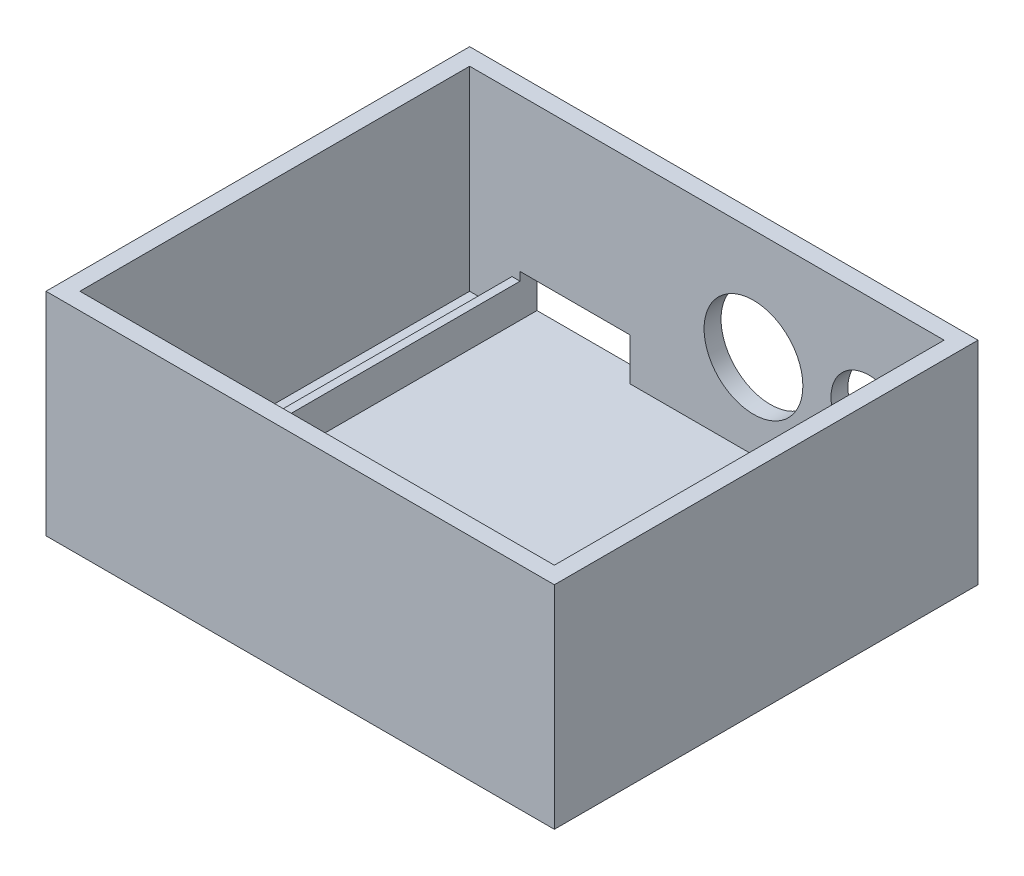
from build123d import *

# Parameters (mm, degrees)
SKETCH1_W           = 120
SKETCH1_H           = 100
BOSS_EXTRUDE1_DEPTH = 50
SKETCH2_W           = 112
SKETCH2_H           = 92
CUT_EXTRUDE1_DEPTH  = 46
SKETCH3_W           = 24.6
SKETCH3_H           = 70
BOSS_EXTRUDE3_DEPTH = 8
SKETCH6_W           = 24.61
SKETCH6_H           = 8
CUT_EXTRUDE4_DEPTH  = 66
SKETCH7_W           = 26
SKETCH7_H           = 10
CUT_EXTRUDE6_DEPTH  = 66
SKETCH10_R          = 9
CUT_EXTRUDE9_DEPTH  = 12.5
SKETCH8_R           = 11.662197426
CUT_EXTRUDE10_DEPTH = 10


with BuildPart() as part:
    # Sketch1 → Boss-Extrude1 (new body)
    with BuildSketch(Plane(origin=(0, 0, 0), x_dir=(1, 0, 0), z_dir=(0, 1, 0))):
        with Locations((-10.571222942, 10.082692781)):
            Rectangle(SKETCH1_W, SKETCH1_H)
    extrude(amount=BOSS_EXTRUDE1_DEPTH)

    # Sketch2 → Cut-Extrude1 (cut)
    with BuildSketch(Plane(origin=(0, 50, 0), x_dir=(1, 0, 0), z_dir=(0, 1, 0))):
        with Locations((-10.571222942, 10.082692781)):
            Rectangle(SKETCH2_W, SKETCH2_H)
    extrude(amount=-CUT_EXTRUDE1_DEPTH, mode=Mode.SUBTRACT)

    # Sketch3 → Boss-Extrude3 (add)
    with BuildSketch(Plane(origin=(0, 4, 0), x_dir=(1, 0, 0), z_dir=(0, 1, 0))):
        with Locations((-44.271222942, 25.082692781)):
            Rectangle(SKETCH3_W, SKETCH3_H)
    extrude(amount=BOSS_EXTRUDE3_DEPTH)

    # Sketch6 → Cut-Extrude4 (cut)
    with BuildSketch(Plane.XY.offset(9.917307219)):
        with Locations((-42.369304131, 8)):
            Rectangle(SKETCH6_W, SKETCH6_H)
    extrude(amount=-CUT_EXTRUDE4_DEPTH, mode=Mode.SUBTRACT)

    # Sketch7 → Cut-Extrude6 (cut)
    with BuildSketch(Plane.XY.offset(-56.082692781)):
        with Locations((-41.674304131, 9)):
            Rectangle(SKETCH7_W, SKETCH7_H)
    extrude(amount=-CUT_EXTRUDE6_DEPTH, mode=Mode.SUBTRACT)

    # Sketch10 → Cut-Extrude9 (cut)
    with BuildSketch(Plane(origin=(0, 0, -60.082692781), x_dir=(-1, 0, 0), z_dir=(0, 0, -1))):
        with Locations((-27.728777058, 25)):
            Circle(SKETCH10_R)
    extrude(amount=-CUT_EXTRUDE9_DEPTH, mode=Mode.SUBTRACT)

    # Sketch8 → Cut-Extrude10 (cut)
    with BuildSketch(Plane.XY.offset(-56.082692781)):
        with Locations((0.428777058, 24)):
            Circle(SKETCH8_R)
    extrude(amount=-CUT_EXTRUDE10_DEPTH, mode=Mode.SUBTRACT)


solid = part.part
